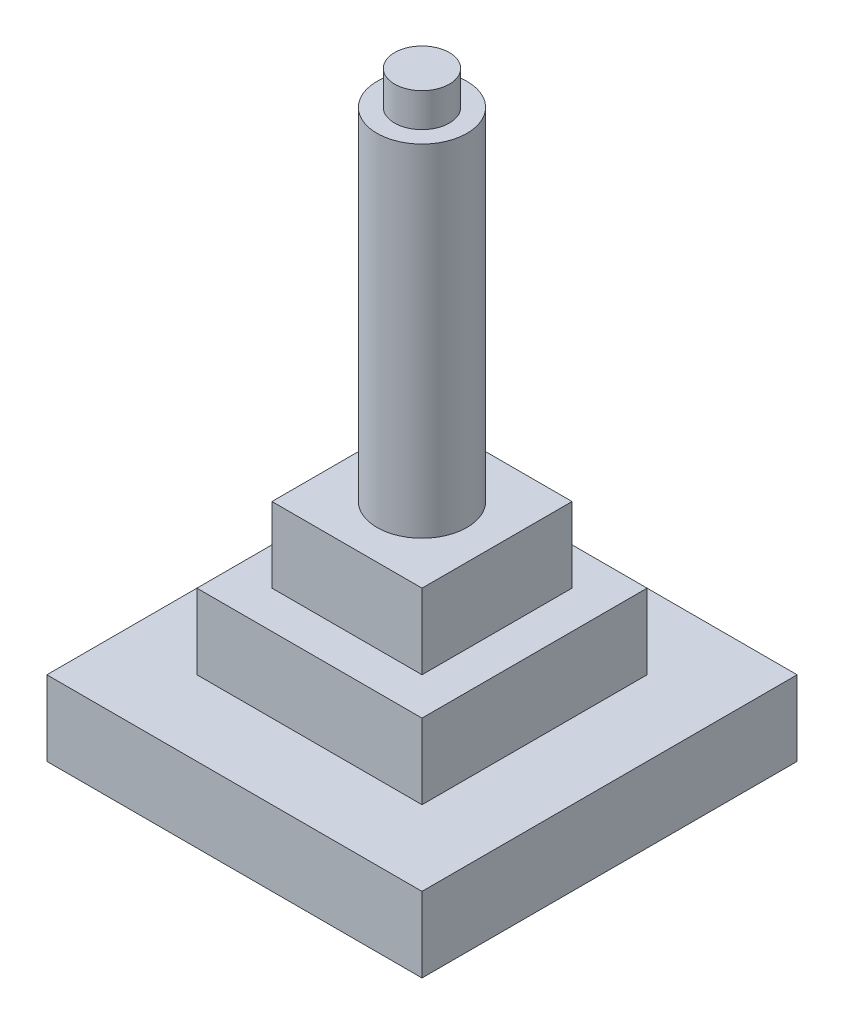
from build123d import *

# Parameters (mm, degrees)
SKETCH1_W           = 500
SKETCH1_H           = 500
BOSS_EXTRUDE1_DEPTH = 100
SKETCH2_W           = 300
SKETCH2_H           = 300
BOSS_EXTRUDE2_DEPTH = 100
SKETCH3_W           = 200
SKETCH3_H           = 200
BOSS_EXTRUDE3_DEPTH = 100
SKETCH4_R           = 60
BOSS_EXTRUDE4_DEPTH = 455
SKETCH5_R           = 36.5
BOSS_EXTRUDE5_DEPTH = 45


with BuildPart() as part:
    # Sketch1 → Boss-Extrude1 (new body)
    with BuildSketch(Plane(origin=(0, 0, 0), x_dir=(1, 0, 0), z_dir=(0, 1, 0))):
        Rectangle(SKETCH1_W, SKETCH1_H)
    extrude(amount=BOSS_EXTRUDE1_DEPTH)

    # Sketch2 → Boss-Extrude2 (add)
    with BuildSketch(Plane(origin=(0, 100, 0), x_dir=(1, 0, 0), z_dir=(0, 1, 0))):
        Rectangle(SKETCH2_W, SKETCH2_H)
    extrude(amount=BOSS_EXTRUDE2_DEPTH)

    # Sketch3 → Boss-Extrude3 (add)
    with BuildSketch(Plane(origin=(0, 200, 0), x_dir=(1, 0, 0), z_dir=(0, 1, 0))):
        Rectangle(SKETCH3_W, SKETCH3_H)
    extrude(amount=BOSS_EXTRUDE3_DEPTH)

    # Sketch4 → Boss-Extrude4 (add)
    with BuildSketch(Plane(origin=(0, 300, 0), x_dir=(1, 0, 0), z_dir=(0, 1, 0))):
        with Locations(Location((0, 0, 0), (0, 0, 90))):
            Circle(SKETCH4_R)
    extrude(amount=BOSS_EXTRUDE4_DEPTH)

    # Sketch5 → Boss-Extrude5 (add)
    with BuildSketch(Plane(origin=(0, 755, 0), x_dir=(1, 0, 0), z_dir=(0, 1, 0))):
        with Locations(Location((0, 0, 0), (0, 0, 90))):
            Circle(SKETCH5_R)
    extrude(amount=BOSS_EXTRUDE5_DEPTH)


solid = part.part
